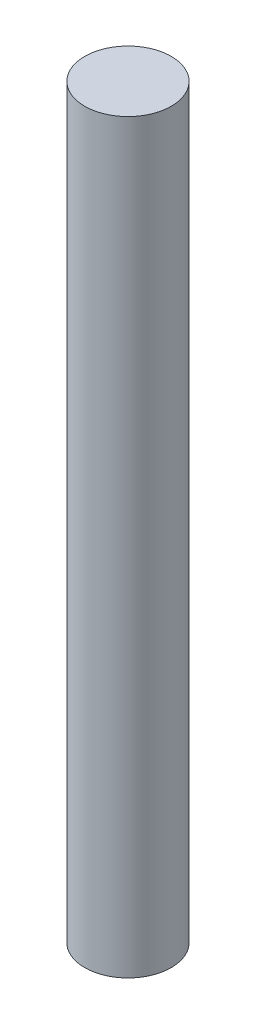
from build123d import *

# Parameters (mm, degrees)
SKETCH1_R           = 4
BOSS_EXTRUDE1_DEPTH = 69


with BuildPart() as part:
    # Sketch1 → Boss-Extrude1 (new body)
    with BuildSketch(Plane(origin=(0, 0, 0), x_dir=(1, 0, 0), z_dir=(0, 1, 0))):
        with Locations(Location((0, 0, 0), (0, 0, 270))):
            Circle(SKETCH1_R)
    extrude(amount=BOSS_EXTRUDE1_DEPTH)


solid = part.part
